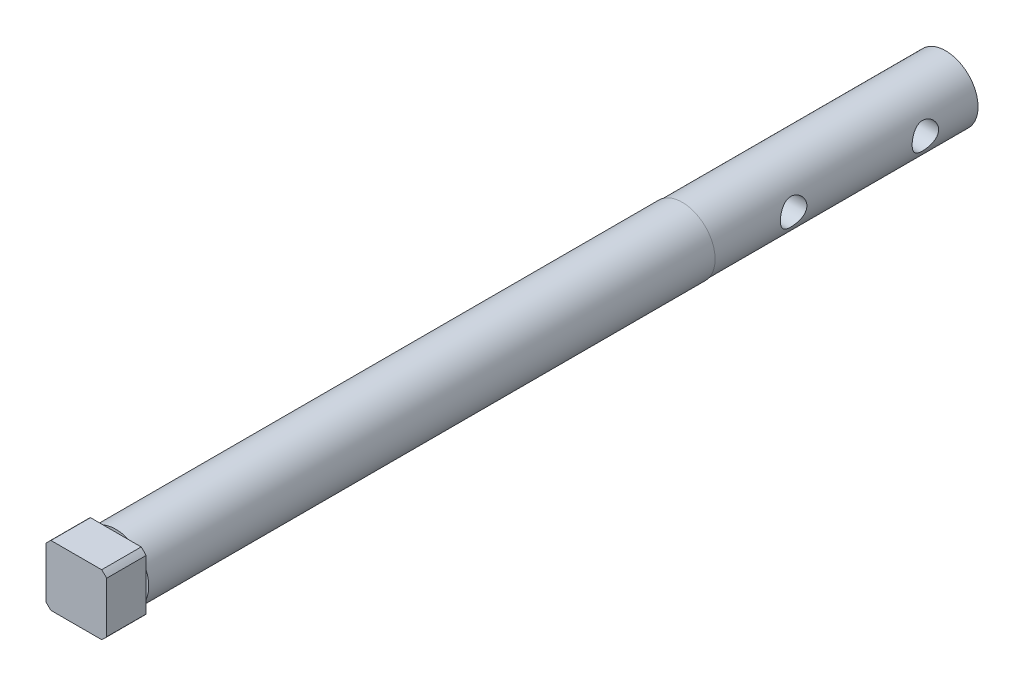
from build123d import *

# Parameters (mm, degrees)
SKETCH1_R               = 30
BOSS_EXTRUDE1_DEPTH     = 330
CUT_EXTRUDE1_DEPTH      = 333.716095192
CUT_EXTRUDE1_DEPTH_BACK = 333.716095192
SKETCH2_R               = 10.05
CUT_EXTRUDE2_DEPTH      = 335.89140043
SKETCH4_OUTSIDE_W       = 195.086
SKETCH4_OUTSIDE_H       = 195.086
SKETCH4_OUTSIDE_W_2     = 46
SKETCH4_OUTSIDE_H_2     = 46
CUT_EXTRUDE3_DEPTH      = 30
SKETCH5_OUTSIDE_W       = 195.086
SKETCH5_OUTSIDE_H       = 195.086
SKETCH5_OUTSIDE_R       = 24.61
CUT_EXTRUDE4_DEPTH      = 200
SKETCH6_OUTSIDE_W       = 195.086
SKETCH6_OUTSIDE_H       = 195.086
SKETCH6_OUTSIDE_R       = 25
CUT_EXTRUDE5_DEPTH      = 430


with BuildPart() as part:
    # Sketch1 → Boss-Extrude1 (new, symmetric)
    with BuildSketch(Plane.XY):
        Circle(SKETCH1_R)
    extrude(amount=BOSS_EXTRUDE1_DEPTH, both=True)

    # Sketch2 → Cut-Extrude1 (cut, two sides: drawn at the far end of the back side and taken through both)
    with BuildSketch(Plane(origin=(0, 0, 0), x_dir=(0, 0, -1), z_dir=(1, 0, 0)).offset(-CUT_EXTRUDE1_DEPTH_BACK)):
        with Locations(Location((190, 0, 0), (0, 0, 180))):
            Circle(SKETCH2_R)
        with Locations(Location((290, 0, 0), (0, 0, 180))):
            Circle(SKETCH2_R)
    extrude(amount=CUT_EXTRUDE1_DEPTH + CUT_EXTRUDE1_DEPTH_BACK, mode=Mode.SUBTRACT)

    # Sketch3 → Cut-Extrude2 (cut, through all)
    with BuildSketch(Plane(origin=(-18.5, 0, 0), x_dir=(0, 0, -1), z_dir=(1, 0, 0))):
        with BuildLine():
            Line((-215, -7), (-173, -7))
            ThreePointArc((-173, -7), (-166, 0), (-173, 7))
            Line((-173, 7), (-215, 7))
            ThreePointArc((-215, 7), (-222, 0), (-215, -7))
        make_face()
    extrude(amount=-CUT_EXTRUDE2_DEPTH, mode=Mode.SUBTRACT)

    # Sketch4 outside → Cut-Extrude3 (cut)
    with BuildSketch(Plane.XY.offset(330)):
        Rectangle(SKETCH4_OUTSIDE_W, SKETCH4_OUTSIDE_H)
        Rectangle(SKETCH4_OUTSIDE_W_2, SKETCH4_OUTSIDE_H_2, mode=Mode.SUBTRACT)
    extrude(amount=-CUT_EXTRUDE3_DEPTH, mode=Mode.SUBTRACT)

    # Sketch5 outside → Cut-Extrude4 (cut)
    with BuildSketch(Plane(origin=(0, 0, -330), x_dir=(-1, 0, 0), z_dir=(0, 0, -1))):
        Rectangle(SKETCH5_OUTSIDE_W, SKETCH5_OUTSIDE_H)
        Circle(SKETCH5_OUTSIDE_R, mode=Mode.SUBTRACT)
    extrude(amount=-CUT_EXTRUDE4_DEPTH, mode=Mode.SUBTRACT)

    # Sketch6 outside → Cut-Extrude5 (cut)
    with BuildSketch(Plane(origin=(0, 0, -130), x_dir=(-1, 0, 0), z_dir=(0, 0, -1))):
        Rectangle(SKETCH6_OUTSIDE_W, SKETCH6_OUTSIDE_H)
        Circle(SKETCH6_OUTSIDE_R, mode=Mode.SUBTRACT)
    extrude(amount=-CUT_EXTRUDE5_DEPTH, mode=Mode.SUBTRACT)


solid = part.part
